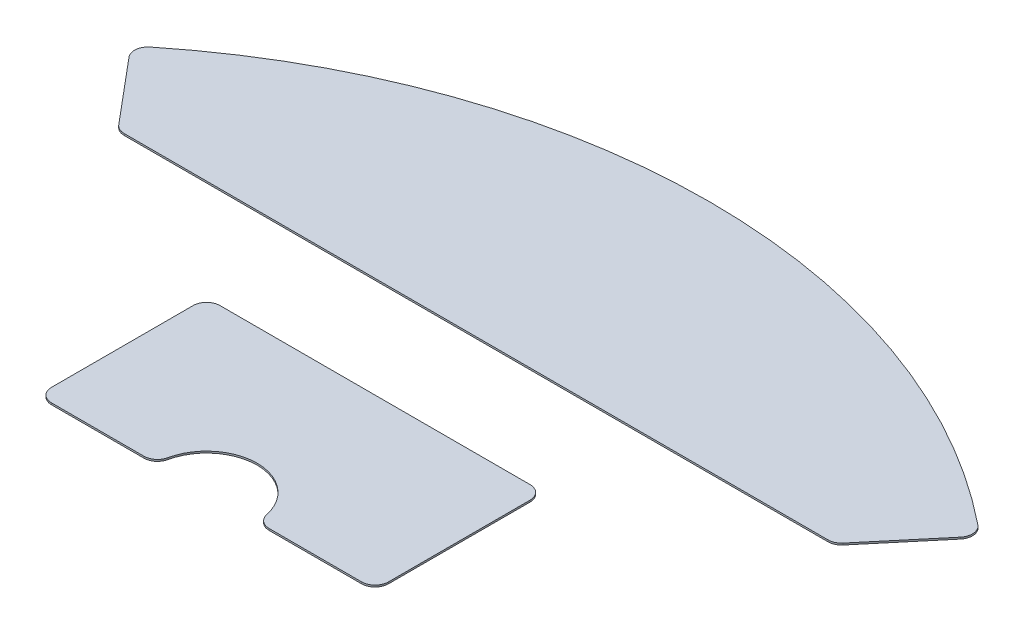
from build123d import *

# Parameters (mm, degrees)
BOSS_EXTRUDE1_DEPTH   = 0.254
BOSS_EXTRUDE1_2_DEPTH = 0.254
FILLET1_R             = 2
FILLET2_R             = 2


with BuildPart() as part:
    # Sketch1 → Boss-Extrude1 (new body)
    with BuildSketch(Plane(origin=(0, 0, 0), x_dir=(1, 0, 0), z_dir=(0, 1, 0))):
        with BuildLine():
            Line((-7.5, 0), (-25, 0))
            Line((-25, 0), (-25, 25))
            Line((-25, 25), (25, 25))
            Line((25, 25), (25, 0))
            Line((25, 0), (7.5, 0))
            ThreePointArc((7.5, 0), (0, 7.5), (-7.5, 0))
        make_face()
    extrude(amount=BOSS_EXTRUDE1_DEPTH)

    # Fillet2
    fillet2_edges = [part.edges().sort_by_distance(p)[0] for p in [
        (-7.5, 0.127, 0),
        (-25, 0.127, 0),
        (-25, 0.127, -25),
        (25, 0.127, -25),
        (25, 0.127, 0),
        (7.5, 0.127, 0),
    ]]
    fillet(fillet2_edges, radius=FILLET2_R)


with BuildPart() as body_2:
    # Sketch1 → Boss-Extrude1 2 (new body)
    with BuildSketch(Plane(origin=(0, 0, 0), x_dir=(1, 0, 0), z_dir=(0, 1, 0))):
        with BuildLine():
            Line((53.145094587, 40), (-53.145094587, 40))
            Line((-53.145094587, 40), (-62.993185749, 51.736498023))
            ThreePointArc((-62.993185749, 51.736498023), (0, 74.664142597), (62.993185749, 51.736498023))
            Line((62.993185749, 51.736498023), (53.145094587, 40))
        make_face()
    extrude(amount=BOSS_EXTRUDE1_2_DEPTH)

    # Fillet1
    fillet1_edges = [body_2.edges().sort_by_distance(p)[0] for p in [
        (53.145094587, 0.127, -40),
        (-53.145094587, 0.127, -40),
        (-62.993185749, 0.127, -51.736498023),
        (62.993185749, 0.127, -51.736498023),
    ]]
    fillet(fillet1_edges, radius=FILLET1_R)


solid = Compound([part.part, body_2.part])
